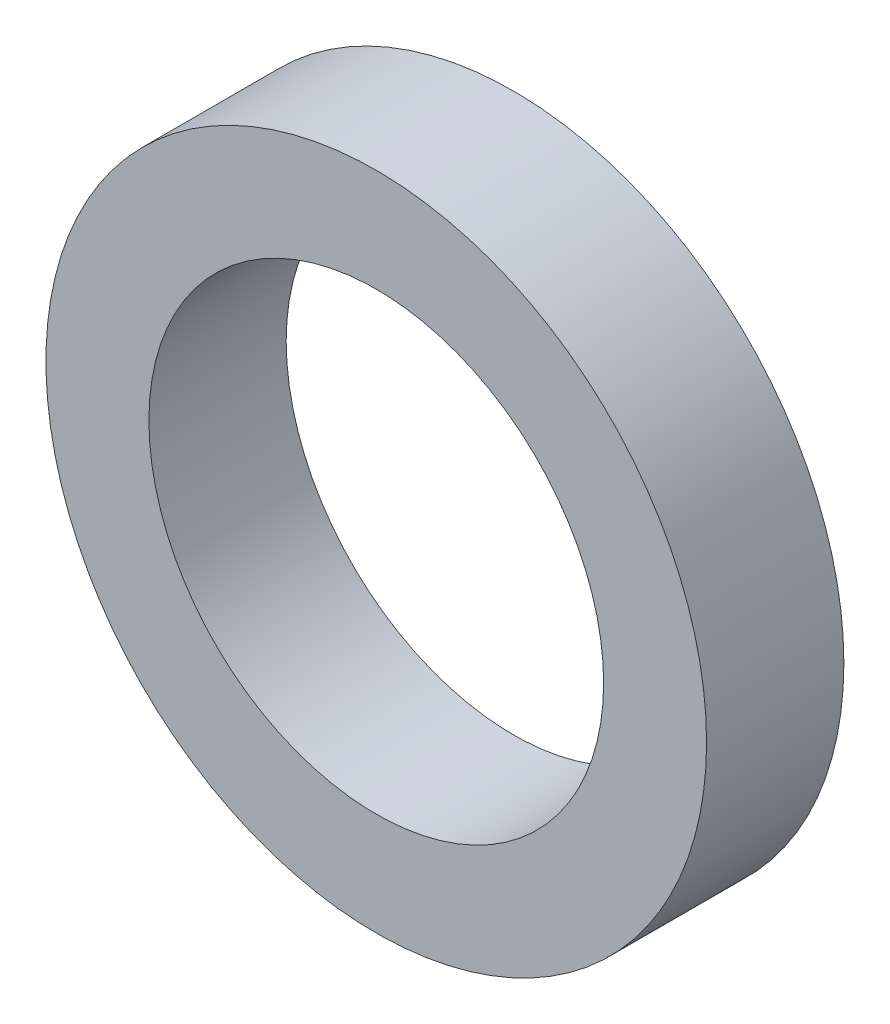
from build123d import *

# Parameters (mm, degrees)
SKETCH1_R           = 3.85
SKETCH1_R_2         = 2.65
BOSS_EXTRUDE1_DEPTH = 1.6


with BuildPart() as part:
    # Sketch1 → Boss-Extrude1 (new body)
    with BuildSketch(Plane.XY):
        Circle(SKETCH1_R)
        Circle(SKETCH1_R_2, mode=Mode.SUBTRACT)
    extrude(amount=BOSS_EXTRUDE1_DEPTH)


solid = part.part
